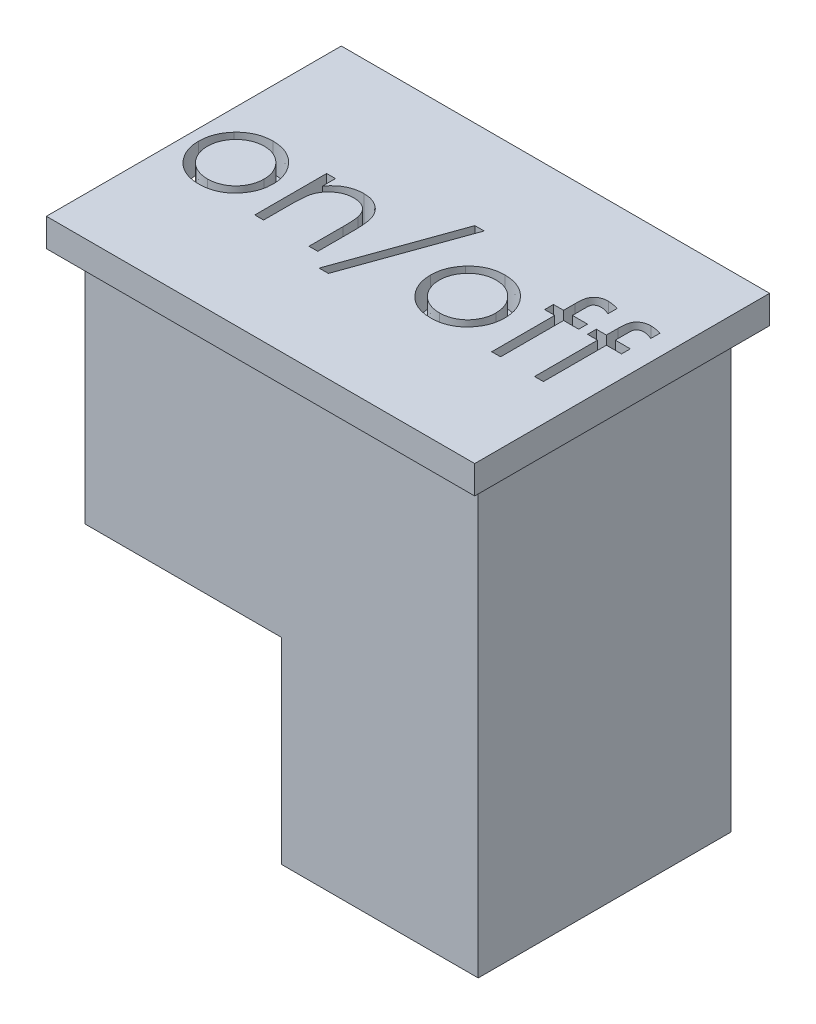
from build123d import *

# Parameters (mm, degrees)
CROQUIS1_W              = 14
CROQUIS1_H              = 9
SALIENTE_EXTRUIR1_DEPTH = 8.55
SALIENTE_EXTRUIR2_START = 8.55
CROQUIS2_W              = 15.25
CROQUIS2_H              = 10.5
SALIENTE_EXTRUIR2_DEPTH = 1
CROQUIS3_W              = 7
CROQUIS3_H              = 9
SALIENTE_EXTRUIR3_DEPTH = 7
CORTAR_EXTRUIR1_DEPTH   = 1


with BuildPart() as part:
    # Croquis1 → Saliente-Extruir1 (new body)
    with BuildSketch(Plane(origin=(0, 0, 0), x_dir=(1, 0, 0), z_dir=(0, 1, 0))):
        Rectangle(CROQUIS1_W, CROQUIS1_H)
    extrude(amount=SALIENTE_EXTRUIR1_DEPTH)

    # Croquis2 → Saliente-Extruir2 (add)
    with BuildSketch(Plane(origin=(0, 0, 0), x_dir=(1, 0, 0), z_dir=(0, 1, 0)).offset(SALIENTE_EXTRUIR2_START)):
        Rectangle(CROQUIS2_W, CROQUIS2_H)
    extrude(amount=SALIENTE_EXTRUIR2_DEPTH)

    # Croquis3 → Saliente-Extruir3 (add)
    with BuildSketch(Plane(origin=(0, 0, 0), x_dir=(1, 0, 0), z_dir=(0, 1, 0))):
        with Locations((3.5, 0)):
            Rectangle(CROQUIS3_W, CROQUIS3_H)
    extrude(amount=-SALIENTE_EXTRUIR3_DEPTH)

    # Croquis4 → Cortar-Extruir1 (cut)
    # profile 1 of 6: a face of its own
    with BuildSketch(Plane(origin=(0, 9.55, 0), x_dir=(1, 0, 0), z_dir=(0, 1, 0))):
        with BuildLine():
            add(Edge.make_bspline(
                [(-5.905649038, 1.102564103), (-5.857657766, 1.101542211), (-5.763558608, 1.099538533), (-5.625750722, 1.078123567), (-5.494205586, 1.045376203), (-5.368419394, 1.000104641), (-5.250003099, 0.93942269), (-5.137231855, 0.867013399), (-5.030414846, 0.781230805), (-4.966391816, 0.714872737), (-4.933894231, 0.681189904)],
                knots=[0, 0, 0, 0, 1.054011418, 2.066658804, 3.057071809, 4.030435133, 4.997543892, 5.974964718, 6.972108034, 8, 8, 8, 8], degree=3))
            add(Edge.make_bspline(
                [(-4.933894231, 0.681189904), (-4.905912277, 0.648975918), (-4.850489896, 0.585171376), (-4.779424178, 0.481715763), (-4.718202618, 0.374575662), (-4.669139657, 0.262328336), (-4.630454633, 0.145953664), (-4.602988937, 0.025051653), (-4.586652002, -0.100110694), (-4.584449035, -0.185114532), (-4.583333333, -0.228165064)],
                knots=[0, 0, 0, 0, 1.025258237, 2.030674902, 3.01204498, 3.988269485, 4.97094183, 5.956517959, 6.965070386, 8, 8, 8, 8], degree=3))
            add(Edge.make_bspline(
                [(-4.583333333, -0.228165064), (-4.584314671, -0.271465122), (-4.586253839, -0.357028055), (-4.604597455, -0.483047421), (-4.633128541, -0.605242244), (-4.673960379, -0.723100937), (-4.726318489, -0.836983765), (-4.790209176, -0.946393314), (-4.866080793, -1.051545447), (-4.95208479, -1.151547286), (-5.047136666, -1.2437135), (-5.150252815, -1.32404177), (-5.259406848, -1.392863294), (-5.376050202, -1.44829971), (-5.499117688, -1.49200941), (-5.628874757, -1.522709427), (-5.765119827, -1.54127111), (-5.858147048, -1.543654684), (-5.905649038, -1.544871795)],
                knots=[0, 0, 0, 0, 0.998656419, 1.973391657, 2.932242238, 3.890759089, 4.846373663, 5.82037756, 6.809684879, 7.83454468, 8.860553229, 9.859544525, 10.845671541, 11.83227036, 12.833544569, 13.85385346, 14.904124723, 16, 16, 16, 16], degree=3))
            add(Edge.make_bspline(
                [(-5.905649038, -1.544871795), (-5.953383758, -1.543650599), (-6.046874618, -1.541258824), (-6.1836006, -1.522781541), (-6.313590219, -1.492023559), (-6.436818817, -1.448156066), (-6.553963664, -1.392861522), (-6.663750161, -1.324249833), (-6.766950076, -1.243689678), (-6.862022061, -1.151553741), (-6.948020666, -1.051543784), (-7.023893675, -0.946393746), (-7.087784001, -0.836983652), (-7.140142205, -0.723100967), (-7.180974018, -0.605242236), (-7.20950511, -0.483047423), (-7.227848725, -0.357028055), (-7.229787893, -0.271465122), (-7.230769231, -0.228165064)],
                knots=[0, 0, 0, 0, 1.099876186, 2.154163076, 3.173186993, 4.173200201, 5.163417411, 6.152872554, 7.150605724, 8.17532212, 9.198891216, 10.186952605, 11.159729845, 12.11414092, 13.071450619, 14.029093627, 15.002601286, 16, 16, 16, 16], degree=3))
            add(Edge.make_bspline(
                [(-7.230769231, -0.228165064), (-7.22964592, -0.185348518), (-7.227421959, -0.100579116), (-7.21110145, 0.024347945), (-7.183742893, 0.145045334), (-7.145011497, 0.26097081), (-7.095496306, 0.372726246), (-7.035135018, 0.480131077), (-6.963344386, 0.583118877), (-6.908142434, 0.646840957), (-6.880208333, 0.679086538)],
                knots=[0, 0, 0, 0, 1.031353054, 2.041901799, 3.029428768, 4.008703097, 4.981709435, 5.96992636, 6.972712378, 8, 8, 8, 8], degree=3))
            add(Edge.make_bspline(
                [(-6.880208333, 0.679086538), (-6.847759742, 0.713061478), (-6.783943878, 0.779879174), (-6.676595151, 0.865411698), (-6.56410133, 0.939327772), (-6.444376403, 0.998803987), (-6.318693546, 1.045642505), (-6.186474303, 1.07820802), (-6.048198788, 1.099461375), (-5.953639166, 1.101519553), (-5.905649038, 1.102564103)],
                knots=[0, 0, 0, 0, 1.027980169, 2.021703884, 2.998553061, 3.971491411, 4.943284454, 5.930300938, 6.949603206, 8, 8, 8, 8], degree=3))
        make_face()
        with BuildLine():
            add(Edge.make_bspline(
                [(-5.907051282, 0.788461538), (-5.940988893, 0.787496947), (-6.007988022, 0.785592664), (-6.106607607, 0.77110876), (-6.201547761, 0.748161255), (-6.292988605, 0.715557199), (-6.380621777, 0.6734583), (-6.46453118, 0.62174994), (-6.54496362, 0.561116984), (-6.620345683, 0.491654312), (-6.689527995, 0.415775317), (-6.750005972, 0.334926959), (-6.801431078, 0.250420612), (-6.844271237, 0.162168401), (-6.876178425, 0.069275987), (-6.899351448, -0.027204644), (-6.913821688, -0.12747006), (-6.915708067, -0.195631079), (-6.916666667, -0.230268429)],
                knots=[0, 0, 0, 0, 1.021534396, 2.016698045, 2.994645724, 3.958388632, 4.93408049, 5.916473867, 6.921342795, 7.962252576, 8.998418191, 10.008913653, 10.997312074, 11.973003931, 12.956656626, 13.948281152, 14.957379055, 16, 16, 16, 16], degree=3))
            add(Edge.make_bspline(
                [(-6.916666667, -0.230268429), (-6.915059843, -0.275020457), (-6.911870599, -0.363844862), (-6.885935362, -0.494655985), (-6.842549082, -0.620237837), (-6.783961803, -0.739854223), (-6.710555584, -0.850526501), (-6.624068517, -0.949197985), (-6.525428817, -1.034383797), (-6.415812317, -1.105064642), (-6.297457999, -1.161224398), (-6.172201678, -1.201023374), (-6.041560984, -1.226895066), (-5.952280252, -1.229466541), (-5.907051282, -1.230769231)],
                knots=[0, 0, 0, 0, 1.016792936, 2.018143844, 3.017858371, 4.030088057, 5.03801393, 6.028138512, 7.003788237, 7.991172063, 8.984598303, 9.972568034, 10.972917682, 12, 12, 12, 12], degree=3))
            add(Edge.make_bspline(
                [(-5.907051282, -1.230769231), (-5.861824913, -1.229458951), (-5.772549317, -1.226872494), (-5.64209014, -1.201153674), (-5.517176168, -1.161050013), (-5.398944781, -1.105127803), (-5.289378177, -1.034115389), (-5.190029056, -0.949679012), (-5.104280445, -0.85026516), (-5.03094684, -0.739707631), (-4.971400097, -0.620423279), (-4.928216896, -0.494632807), (-4.90221931, -0.363850765), (-4.899038481, -0.275022434), (-4.897435897, -0.230268429)],
                knots=[0, 0, 0, 0, 1.02726834, 2.027799167, 3.010890988, 4.004497153, 4.992059811, 5.971914811, 6.958719428, 7.966827853, 8.981595046, 9.981490638, 10.983022906, 12, 12, 12, 12], degree=3))
            add(Edge.make_bspline(
                [(-4.897435897, -0.230268429), (-4.898394167, -0.195630872), (-4.900279897, -0.127469446), (-4.914754861, -0.027206993), (-4.937910401, 0.069284604), (-4.969882018, 0.162136607), (-5.012536032, 0.250649112), (-5.064952825, 0.334678839), (-5.12518385, 0.416055385), (-5.195200971, 0.491409026), (-5.270504349, 0.561144062), (-5.350969387, 0.621773452), (-5.434754366, 0.673231047), (-5.522132948, 0.715917288), (-5.613585516, 0.747864628), (-5.708392645, 0.771241259), (-5.806591455, 0.785531456), (-5.873350498, 0.787478598), (-5.907051282, 0.788461538)],
                knots=[0, 0, 0, 0, 1.042956736, 2.052379634, 3.044323526, 4.02829302, 5.004299113, 5.996692471, 7.007513377, 8.048758398, 9.090003419, 10.095195979, 11.07790575, 12.047570684, 13.018257071, 13.989683339, 14.985167495, 16, 16, 16, 16], degree=3))
        make_face(mode=Mode.SUBTRACT)
    # profile 2 of 6: a face of its own
    with BuildSketch(Plane(origin=(0, 9.55, 0), x_dir=(1, 0, 0), z_dir=(0, 1, 0))):
        with BuildLine():
            Line((-3.955128205, 1.057692308), (-3.641025641, 1.057692308))
            Line((-3.641025641, 1.057692308), (-3.641025641, 0.596354167))
            add(Edge.make_bspline(
                [(-3.641025641, 0.596354167), (-3.607488006, 0.63819689), (-3.542407055, 0.719394153), (-3.434022722, 0.826114728), (-3.319478821, 0.914059953), (-3.199476818, 0.984163747), (-3.073853808, 1.037010373), (-2.943375538, 1.075176304), (-2.807260832, 1.098061132), (-2.714696395, 1.101051363), (-2.66786859, 1.102564103)],
                knots=[0, 0, 0, 0, 1.12780773, 2.188550248, 3.19190651, 4.159438251, 5.104880172, 6.052711206, 7.014878035, 8, 8, 8, 8], degree=3))
            add(Edge.make_bspline(
                [(-2.66786859, 1.102564103), (-2.620537956, 1.100818907), (-2.527900488, 1.097403139), (-2.393022426, 1.070386448), (-2.267049033, 1.024241192), (-2.150429477, 0.961029122), (-2.045302264, 0.882422649), (-1.952977412, 0.790844867), (-1.876614165, 0.685508784), (-1.825416802, 0.587785627), (-1.791691154, 0.501096833), (-1.770458817, 0.426850083), (-1.752427835, 0.344131932), (-1.736796087, 0.253192343), (-1.726218975, 0.153394153), (-1.717876684, 0.045146461), (-1.711897989, -0.07151567), (-1.711660782, -0.152202297), (-1.711538462, -0.193810096)],
                knots=[0, 0, 0, 0, 1.235846778, 2.418850247, 3.575807741, 4.728682307, 5.871620074, 6.994088408, 8.11269785, 9.256955736, 9.865816715, 10.540099792, 11.271859618, 12.076849838, 12.949306005, 13.892391288, 14.913166135, 16, 16, 16, 16], degree=3))
            Line((-1.711538462, -0.193810096), (-1.711538462, -1.5))
            Line((-1.711538462, -1.5), (-2.025641026, -1.5))
            Line((-2.025641026, -1.5), (-2.025641026, -0.296875))
            add(Edge.make_bspline(
                [(-2.025641026, -0.296875), (-2.025834234, -0.262052555), (-2.026203808, -0.195443144), (-2.027369454, -0.100074121), (-2.030179261, -0.013587543), (-2.034127574, 0.063809825), (-2.039906604, 0.132043661), (-2.045929236, 0.191252938), (-2.053294213, 0.24136248), (-2.059857126, 0.271527563), (-2.062800481, 0.28505609)],
                knots=[0, 0, 0, 0, 1.430800155, 2.736877192, 3.918605307, 4.986035426, 5.920637409, 6.731861385, 7.431261377, 8, 8, 8, 8], degree=3))
            add(Edge.make_bspline(
                [(-2.062800481, 0.28505609), (-2.073426012, 0.324767275), (-2.093876873, 0.401199019), (-2.144410856, 0.504873372), (-2.208225037, 0.59307156), (-2.286122886, 0.665248281), (-2.377351962, 0.721419118), (-2.481659105, 0.760393073), (-2.598037745, 0.784769342), (-2.679892128, 0.787196474), (-2.72255609, 0.788461538)],
                knots=[0, 0, 0, 0, 1.084156227, 2.086665306, 3.027808233, 3.945421172, 4.874247719, 5.839848303, 6.874090471, 8, 8, 8, 8], degree=3))
            add(Edge.make_bspline(
                [(-2.72255609, 0.788461538), (-2.747823773, 0.787985534), (-2.797827866, 0.787043533), (-2.871977838, 0.777592235), (-2.943902011, 0.762133779), (-3.01432222, 0.741265142), (-3.081830014, 0.712602873), (-3.148594305, 0.680073502), (-3.212101069, 0.63952529), (-3.273704467, 0.594334669), (-3.331017274, 0.544255462), (-3.384345613, 0.491410952), (-3.431883633, 0.435135348), (-3.474952308, 0.3763354), (-3.512130572, 0.314203562), (-3.54458366, 0.249339256), (-3.572119354, 0.181657107), (-3.585802047, 0.134682046), (-3.592648237, 0.111177885)],
                knots=[0, 0, 0, 0, 1.023777757, 2.026029729, 3.023749952, 4.003683103, 4.997618607, 5.993177895, 7.010360494, 8.046726602, 9.087585522, 10.09234134, 11.086953743, 12.070360549, 13.043493632, 14.017870808, 15.008233677, 16, 16, 16, 16], degree=3))
            add(Edge.make_bspline(
                [(-3.592648237, 0.111177885), (-3.596587886, 0.093922682), (-3.605164295, 0.056359007), (-3.614427474, -0.005285412), (-3.62283505, -0.076595387), (-3.629872008, -0.157487704), (-3.634177425, -0.248245579), (-3.638871822, -0.348481417), (-3.640580883, -0.458594906), (-3.640873237, -0.535256598), (-3.641025641, -0.575220353)],
                knots=[0, 0, 0, 0, 0.615963638, 1.340920617, 2.168419149, 3.115676021, 4.16674242, 5.331190069, 6.6087489, 8, 8, 8, 8], degree=3))
            Line((-3.641025641, -0.575220353), (-3.641025641, -1.5))
            Line((-3.641025641, -1.5), (-3.955128205, -1.5))
            Line((-3.955128205, -1.5), (-3.955128205, 1.057692308))
        make_face()
    # profile 3 of 6: a face of its own
    with BuildSketch(Plane(origin=(0, 9.55, 0), x_dir=(1, 0, 0), z_dir=(0, 1, 0))):
        Polygon((0.621794872, 2.08974359), (-0.842147436, -1.993589744), (-1.173076923, -1.993589744), (0.290865385, 2.08974359), align=None)
    # profile 4 of 6: a face of its own
    with BuildSketch(Plane(origin=(0, 9.55, 0), x_dir=(1, 0, 0), z_dir=(0, 1, 0))):
        with BuildLine():
            add(Edge.make_bspline(
                [(2.350761218, 1.102564103), (2.398752491, 1.101542211), (2.492851648, 1.099538533), (2.630659534, 1.078123567), (2.76220467, 1.045376203), (2.887990862, 1.000104641), (3.006407158, 0.93942269), (3.119178402, 0.867013399), (3.225995411, 0.781230805), (3.29001844, 0.714872737), (3.322516026, 0.681189904)],
                knots=[0, 0, 0, 0, 1.054011418, 2.066658804, 3.057071809, 4.030435133, 4.997543892, 5.974964718, 6.972108034, 8, 8, 8, 8], degree=3))
            add(Edge.make_bspline(
                [(3.322516026, 0.681189904), (3.35049798, 0.648975918), (3.40592036, 0.585171376), (3.476986079, 0.481715763), (3.538207639, 0.374575662), (3.5872706, 0.262328336), (3.625955624, 0.145953664), (3.65342132, 0.025051653), (3.669758255, -0.100110694), (3.671961222, -0.185114532), (3.673076923, -0.228165064)],
                knots=[0, 0, 0, 0, 1.025258237, 2.030674902, 3.01204498, 3.988269485, 4.97094183, 5.956517959, 6.965070386, 8, 8, 8, 8], degree=3))
            add(Edge.make_bspline(
                [(3.673076923, -0.228165064), (3.672095586, -0.271465122), (3.670156417, -0.357028055), (3.651812801, -0.483047421), (3.623281715, -0.605242244), (3.582449877, -0.723100937), (3.530091768, -0.836983765), (3.46620108, -0.946393314), (3.390329463, -1.051545447), (3.304325466, -1.151547286), (3.20927359, -1.2437135), (3.106157442, -1.32404177), (2.997003408, -1.392863294), (2.880360055, -1.44829971), (2.757292568, -1.49200941), (2.6275355, -1.522709427), (2.49129043, -1.54127111), (2.398263208, -1.543654684), (2.350761218, -1.544871795)],
                knots=[0, 0, 0, 0, 0.998656419, 1.973391657, 2.932242238, 3.890759089, 4.846373663, 5.82037756, 6.809684879, 7.83454468, 8.860553229, 9.859544525, 10.845671541, 11.83227036, 12.833544569, 13.85385346, 14.904124723, 16, 16, 16, 16], degree=3))
            add(Edge.make_bspline(
                [(2.350761218, -1.544871795), (2.303026498, -1.543650599), (2.209535639, -1.541258824), (2.072809657, -1.522781541), (1.942820038, -1.492023559), (1.819591439, -1.448156066), (1.702446592, -1.392861522), (1.592660095, -1.324249833), (1.48946018, -1.243689678), (1.394388196, -1.151553741), (1.30838959, -1.051543784), (1.232516582, -0.946393746), (1.168626256, -0.836983652), (1.116268052, -0.723100967), (1.075436239, -0.605242236), (1.046905146, -0.483047423), (1.028561532, -0.357028055), (1.026622363, -0.271465122), (1.025641026, -0.228165064)],
                knots=[0, 0, 0, 0, 1.099876186, 2.154163076, 3.173186993, 4.173200201, 5.163417411, 6.152872554, 7.150605724, 8.17532212, 9.198891216, 10.186952605, 11.159729845, 12.11414092, 13.071450619, 14.029093627, 15.002601286, 16, 16, 16, 16], degree=3))
            add(Edge.make_bspline(
                [(1.025641026, -0.228165064), (1.026764336, -0.185348518), (1.028988297, -0.100579116), (1.045308807, 0.024347945), (1.072667363, 0.145045334), (1.111398759, 0.26097081), (1.16091395, 0.372726246), (1.221275238, 0.480131077), (1.293065871, 0.583118877), (1.348267822, 0.646840957), (1.376201923, 0.679086538)],
                knots=[0, 0, 0, 0, 1.031353054, 2.041901799, 3.029428768, 4.008703097, 4.981709435, 5.96992636, 6.972712378, 8, 8, 8, 8], degree=3))
            add(Edge.make_bspline(
                [(1.376201923, 0.679086538), (1.408650514, 0.713061478), (1.472466378, 0.779879174), (1.579815106, 0.865411698), (1.692308927, 0.939327772), (1.812033853, 0.998803987), (1.937716711, 1.045642505), (2.069935953, 1.07820802), (2.208211469, 1.099461375), (2.30277109, 1.101519553), (2.350761218, 1.102564103)],
                knots=[0, 0, 0, 0, 1.027980169, 2.021703884, 2.998553061, 3.971491411, 4.943284454, 5.930300938, 6.949603206, 8, 8, 8, 8], degree=3))
        make_face()
        with BuildLine():
            add(Edge.make_bspline(
                [(2.349358974, 0.788461538), (2.315421363, 0.787496947), (2.248422234, 0.785592664), (2.14980265, 0.77110876), (2.054862496, 0.748161255), (1.963421652, 0.715557199), (1.875788479, 0.6734583), (1.791879077, 0.62174994), (1.711446637, 0.561116984), (1.636064574, 0.491654312), (1.566882261, 0.415775317), (1.506404285, 0.334926959), (1.454979178, 0.250420612), (1.412139019, 0.162168401), (1.380231831, 0.069275987), (1.357058809, -0.027204644), (1.342588568, -0.12747006), (1.34070219, -0.195631079), (1.33974359, -0.230268429)],
                knots=[0, 0, 0, 0, 1.021534396, 2.016698045, 2.994645724, 3.958388632, 4.93408049, 5.916473867, 6.921342795, 7.962252576, 8.998418191, 10.008913653, 10.997312074, 11.973003931, 12.956656626, 13.948281152, 14.957379055, 16, 16, 16, 16], degree=3))
            add(Edge.make_bspline(
                [(1.33974359, -0.230268429), (1.341350413, -0.275020457), (1.344539658, -0.363844862), (1.370474894, -0.494655985), (1.413861174, -0.620237837), (1.472448454, -0.739854223), (1.545854673, -0.850526501), (1.632341739, -0.949197985), (1.73098144, -1.034383797), (1.84059794, -1.105064642), (1.958952258, -1.161224398), (2.084208579, -1.201023374), (2.214849273, -1.226895066), (2.304130004, -1.229466541), (2.349358974, -1.230769231)],
                knots=[0, 0, 0, 0, 1.016792936, 2.018143844, 3.017858371, 4.030088057, 5.03801393, 6.028138512, 7.003788237, 7.991172063, 8.984598303, 9.972568034, 10.972917682, 12, 12, 12, 12], degree=3))
            add(Edge.make_bspline(
                [(2.349358974, -1.230769231), (2.394585343, -1.229458951), (2.483860939, -1.226872494), (2.614320116, -1.201153674), (2.739234088, -1.161050013), (2.857465475, -1.105127803), (2.967032079, -1.034115389), (3.0663812, -0.949679012), (3.152129811, -0.85026516), (3.225463416, -0.739707631), (3.285010159, -0.620423279), (3.328193361, -0.494632807), (3.354190947, -0.363850765), (3.357371775, -0.275022434), (3.358974359, -0.230268429)],
                knots=[0, 0, 0, 0, 1.02726834, 2.027799167, 3.010890988, 4.004497153, 4.992059811, 5.971914811, 6.958719428, 7.966827853, 8.981595046, 9.981490638, 10.983022906, 12, 12, 12, 12], degree=3))
            add(Edge.make_bspline(
                [(3.358974359, -0.230268429), (3.358016089, -0.195630872), (3.35613036, -0.127469446), (3.341655395, -0.027206993), (3.318499856, 0.069284604), (3.286528239, 0.162136607), (3.243874225, 0.250649112), (3.191457432, 0.334678839), (3.131226406, 0.416055385), (3.061209285, 0.491409026), (2.985905907, 0.561144062), (2.905440869, 0.621773452), (2.821655891, 0.673231047), (2.734277308, 0.715917288), (2.64282474, 0.747864628), (2.548017611, 0.771241259), (2.449818801, 0.785531456), (2.383059758, 0.787478598), (2.349358974, 0.788461538)],
                knots=[0, 0, 0, 0, 1.042956736, 2.052379634, 3.044323526, 4.02829302, 5.004299113, 5.996692471, 7.007513377, 8.048758398, 9.090003419, 10.095195979, 11.07790575, 12.047570684, 13.018257071, 13.989683339, 14.985167495, 16, 16, 16, 16], degree=3))
        make_face(mode=Mode.SUBTRACT)
    # profile 5 of 6: a face of its own
    with BuildSketch(Plane(origin=(0, 9.55, 0), x_dir=(1, 0, 0), z_dir=(0, 1, 0))):
        with BuildLine():
            Line((5.378205128, 2.068709936), (5.378205128, 1.741987179))
            add(Edge.make_bspline(
                [(5.378205128, 1.741987179), (5.348466349, 1.753938052), (5.292021528, 1.776621056), (5.208781152, 1.801285681), (5.132252318, 1.817221421), (5.083098428, 1.819457366), (5.059895833, 1.820512821)],
                knots=[0, 0, 0, 0, 1.16548392, 2.212112691, 3.15604595, 4, 4, 4, 4], degree=3))
            add(Edge.make_bspline(
                [(5.059895833, 1.820512821), (5.044222069, 1.81986148), (5.01388289, 1.818600703), (4.970279563, 1.812172427), (4.930990354, 1.799069626), (4.896084733, 1.78204035), (4.867134273, 1.760686166), (4.842348049, 1.739230902), (4.824381519, 1.715045722), (4.814626572, 1.692525311), (4.808676571, 1.671674318), (4.806886443, 1.650320052), (4.802501528, 1.624095966), (4.801278722, 1.591932248), (4.798491353, 1.554829537), (4.798737994, 1.512002641), (4.796454071, 1.464125498), (4.796795986, 1.430224949), (4.79697516, 1.412459936)],
                knots=[0, 0, 0, 0, 1.311993654, 2.539582093, 3.670788641, 4.763509788, 5.772417512, 6.671800701, 7.496729179, 8.266799162, 8.712543678, 9.304149002, 10.05334463, 10.934920737, 11.99209668, 13.165090968, 14.514413552, 16, 16, 16, 16], degree=3))
            Line((4.79697516, 1.412459936), (4.79697516, 1.057692308))
            Line((4.79697516, 1.057692308), (5.333333333, 1.057692308))
            Line((5.333333333, 1.057692308), (5.333333333, 0.743589744))
            Line((5.333333333, 0.743589744), (4.796274038, 0.743589744))
            Line((4.796274038, 0.743589744), (4.794871795, -1.5))
            Line((4.794871795, -1.5), (4.480769231, -1.5))
            Line((4.480769231, -1.5), (4.480769231, 0.743589744))
            Line((4.480769231, 0.743589744), (4.121794872, 0.743589744))
            Line((4.121794872, 0.743589744), (4.121794872, 1.057692308))
            Line((4.121794872, 1.057692308), (4.480769231, 1.057692308))
            Line((4.480769231, 1.057692308), (4.480769231, 1.466446314))
            add(Edge.make_bspline(
                [(4.480769231, 1.466446314), (4.480794445, 1.489121894), (4.480842817, 1.532622798), (4.484230667, 1.595232239), (4.487126388, 1.653055703), (4.492894016, 1.705644336), (4.499555722, 1.753490479), (4.509091881, 1.79588336), (4.518103252, 1.833965119), (4.534451844, 1.877067776), (4.558874063, 1.9259178), (4.59840426, 1.9775417), (4.645797267, 2.023846647), (4.702405591, 2.062854), (4.766121126, 2.095269478), (4.837002305, 2.118511331), (4.914277502, 2.131651776), (4.967764972, 2.133605985), (4.995392628, 2.134615385)],
                knots=[0, 0, 0, 0, 1.116398763, 2.141702935, 3.087165306, 3.966655413, 4.746276475, 5.464069668, 6.106083417, 6.67047701, 7.730773247, 8.782666744, 9.856985883, 10.980834087, 12.154321827, 13.366232824, 14.639591414, 16, 16, 16, 16], degree=3))
            add(Edge.make_bspline(
                [(4.995392628, 2.134615385), (5.023469386, 2.133658004), (5.082415051, 2.131648034), (5.174611653, 2.119214627), (5.274208171, 2.097743597), (5.342544092, 2.078665712), (5.378205128, 2.068709936)],
                knots=[0, 0, 0, 0, 0.864728408, 1.815451418, 2.859995356, 4, 4, 4, 4], degree=3))
        make_face()
    # profile 6 of 6: a face of its own
    with BuildSketch(Plane(origin=(0, 9.55, 0), x_dir=(1, 0, 0), z_dir=(0, 1, 0))):
        with BuildLine():
            Line((6.903846154, 2.068709936), (6.903846154, 1.741987179))
            add(Edge.make_bspline(
                [(6.903846154, 1.741987179), (6.874107375, 1.753938052), (6.817662554, 1.776621056), (6.734422178, 1.801285681), (6.657893344, 1.817221421), (6.608739454, 1.819457366), (6.585536859, 1.820512821)],
                knots=[0, 0, 0, 0, 1.16548392, 2.212112691, 3.15604595, 4, 4, 4, 4], degree=3))
            add(Edge.make_bspline(
                [(6.585536859, 1.820512821), (6.569863095, 1.81986148), (6.539523916, 1.818600703), (6.495920589, 1.812172427), (6.456631379, 1.799069626), (6.421725759, 1.78204035), (6.392775299, 1.760686166), (6.367989074, 1.739230902), (6.350022545, 1.715045722), (6.340267597, 1.692525311), (6.334317596, 1.671674318), (6.332527468, 1.650320052), (6.328142554, 1.624095966), (6.326919747, 1.591932248), (6.324132379, 1.554829537), (6.32437902, 1.512002641), (6.322095097, 1.464125498), (6.322437011, 1.430224949), (6.322616186, 1.412459936)],
                knots=[0, 0, 0, 0, 1.311993654, 2.539582093, 3.670788641, 4.763509788, 5.772417512, 6.671800701, 7.496729179, 8.266799162, 8.712543678, 9.304149002, 10.05334463, 10.934920737, 11.99209668, 13.165090968, 14.514413552, 16, 16, 16, 16], degree=3))
            Line((6.322616186, 1.412459936), (6.322616186, 1.057692308))
            Line((6.322616186, 1.057692308), (6.858974359, 1.057692308))
            Line((6.858974359, 1.057692308), (6.858974359, 0.743589744))
            Line((6.858974359, 0.743589744), (6.321915064, 0.743589744))
            Line((6.321915064, 0.743589744), (6.320512821, -1.5))
            Line((6.320512821, -1.5), (6.006410256, -1.5))
            Line((6.006410256, -1.5), (6.006410256, 0.743589744))
            Line((6.006410256, 0.743589744), (5.647435897, 0.743589744))
            Line((5.647435897, 0.743589744), (5.647435897, 1.057692308))
            Line((5.647435897, 1.057692308), (6.006410256, 1.057692308))
            Line((6.006410256, 1.057692308), (6.006410256, 1.466446314))
            add(Edge.make_bspline(
                [(6.006410256, 1.466446314), (6.006435471, 1.489121894), (6.006483842, 1.532622798), (6.009871693, 1.595232239), (6.012767413, 1.653055703), (6.018535041, 1.705644336), (6.025196747, 1.753490479), (6.034732907, 1.79588336), (6.043744278, 1.833965119), (6.06009287, 1.877067776), (6.084515089, 1.9259178), (6.124045286, 1.9775417), (6.171438293, 2.023846647), (6.228046617, 2.062854), (6.291762152, 2.095269478), (6.36264333, 2.118511331), (6.439918528, 2.131651776), (6.493405998, 2.133605985), (6.521033654, 2.134615385)],
                knots=[0, 0, 0, 0, 1.116398763, 2.141702935, 3.087165306, 3.966655413, 4.746276475, 5.464069668, 6.106083417, 6.67047701, 7.730773247, 8.782666744, 9.856985883, 10.980834087, 12.154321827, 13.366232824, 14.639591414, 16, 16, 16, 16], degree=3))
            add(Edge.make_bspline(
                [(6.521033654, 2.134615385), (6.549110412, 2.133658004), (6.608056076, 2.131648034), (6.700252679, 2.119214627), (6.799849196, 2.097743597), (6.868185117, 2.078665712), (6.903846154, 2.068709936)],
                knots=[0, 0, 0, 0, 0.864728408, 1.815451418, 2.859995356, 4, 4, 4, 4], degree=3))
        make_face()
    extrude(amount=-CORTAR_EXTRUIR1_DEPTH, mode=Mode.SUBTRACT)


solid = part.part
